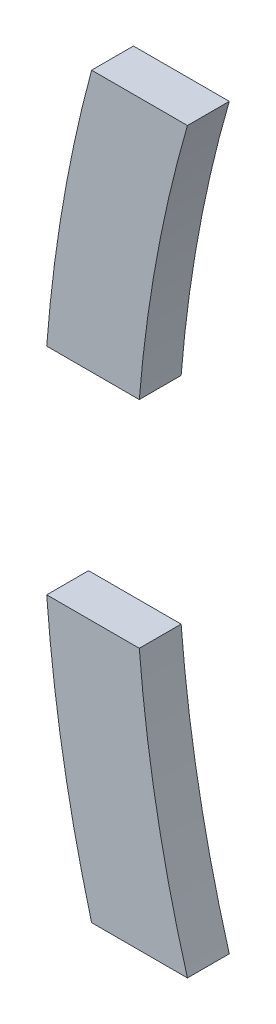
from build123d import *

# Parameters (mm, degrees)
SKETCH1_R           = 3.175
BOSS_EXTRUDE1_DEPTH = 17.272
CUT_EXTRUDE1_START  = -17.272
CUT_EXTRUDE1_DEPTH  = 17.272


with BuildPart() as part:
    # Sketch1 → Boss-Extrude1 (new body)
    with BuildSketch(Plane.XY):
        with BuildLine():
            Line((-517.469519919, 241.3), (-494.934682501, 230.791832737))
            ThreePointArc((-494.934682501, 230.791832737), (-546.1, 0), (-494.934682501, -230.791832737))
            Line((-494.934682501, -230.791832737), (-517.469519919, -241.3))
            Line((-517.469519919, -241.3), (-532.037545668, -241.3))
            ThreePointArc((-532.037545668, -241.3), (-584.2, 0), (-532.037545668, 241.3))
            Line((-532.037545668, 241.3), (-517.469519919, 241.3))
        make_face()
        with Locations((-565.069727445, 9.525)):
            Circle(SKETCH1_R, mode=Mode.SUBTRACT)
        with Locations((-565.069727445, -9.525)):
            Circle(SKETCH1_R, mode=Mode.SUBTRACT)
        with Locations((-526.121546674, 206.375)):
            Circle(SKETCH1_R, mode=Mode.SUBTRACT)
        with Locations((-533.201525575, 187.325)):
            Circle(SKETCH1_R, mode=Mode.SUBTRACT)
        with Locations((-526.121546674, -206.375)):
            Circle(SKETCH1_R, mode=Mode.SUBTRACT)
        with Locations((-533.201525575, -187.325)):
            Circle(SKETCH1_R, mode=Mode.SUBTRACT)
    extrude(amount=BOSS_EXTRUDE1_DEPTH)

    # Sketch2 → Cut-Extrude1 (cut)
    with BuildSketch(Plane.XY.offset(17.272).offset(CUT_EXTRUDE1_START)):
        with BuildLine():
            Line((-595.242645902, 44.45), (-544.287982138, 44.45))
            ThreePointArc((-544.287982138, 44.45), (-546.1, 0), (-544.287982138, -44.45))
            Line((-544.287982138, -44.45), (-595.242645902, -44.45))
            ThreePointArc((-595.242645902, -44.45), (-596.9, 0), (-595.242645902, 44.45))
        make_face()
        with BuildLine():
            Line((-543.101360245, -247.65), (-486.718283507, -247.65))
            ThreePointArc((-486.718283507, -247.65), (-507.799328434, -200.910557317), (-524.40389968, -152.4))
            Line((-524.40389968, -152.4), (-577.116842589, -152.4))
            ThreePointArc((-577.116842589, -152.4), (-562.130186091, -200.746765565), (-543.101360245, -247.65))
        make_face()
        with BuildLine():
            Line((-543.101360245, 247.65), (-486.718283507, 247.65))
            ThreePointArc((-486.718283507, 247.65), (-507.799328434, 200.910557317), (-524.40389968, 152.4))
            Line((-524.40389968, 152.4), (-577.116842589, 152.4))
            ThreePointArc((-577.116842589, 152.4), (-562.130186091, 200.746765565), (-543.101360245, 247.65))
        make_face()
    extrude(amount=CUT_EXTRUDE1_DEPTH, mode=Mode.SUBTRACT)


with BuildPart() as cut_extrude1_piece_1:
    # of the separate pieces the step leaves, piece 1, a body of its own (cut_extrude1_pieces)
    add(part.part.solids().sort_by_distance((-563.971524104, -152.4, 0))[0])


with BuildPart() as cut_extrude1_piece_2:
    # of the separate pieces the step leaves, piece 2, a body of its own (cut_extrude1_pieces)
    add(part.part.solids().sort_by_distance((-582.506512839, 44.45, 0))[0])


solid = Compound([cut_extrude1_piece_1.part, cut_extrude1_piece_2.part])
